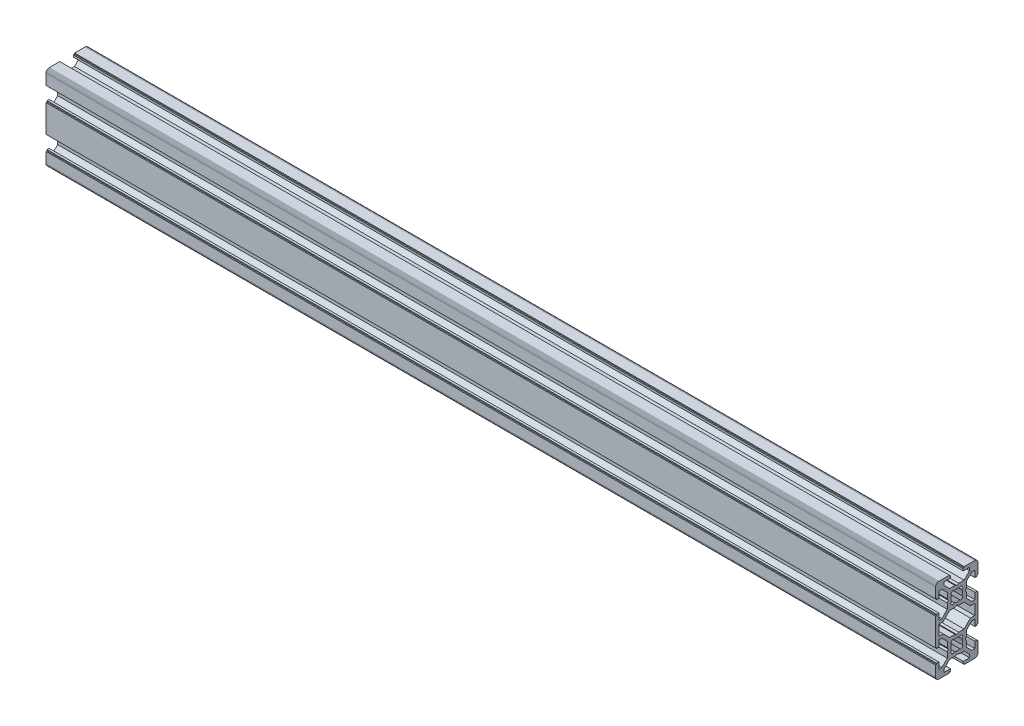
from build123d import *

# Parameters (mm, degrees)
F_20MM_20X40_1_DEPTH = 420


with BuildPart() as part:
    # Model1 → 20mm 20X40(1) (new body)
    with BuildSketch(Plane.YZ):
        Polygon((-19.998489, -8.567297), (-20, -8.5), (-20, -3.5), (-19.5, -3.5), (-19.5, -3), (-18.5, -3), (-18.5, -6), (-17.060659, -6), (-14.5, -3.43934), (-14.5, -0.866025), (-14, 0), (-14.5, 0.866025), (-14.5, 3.43934), (-17.060659, 6), (-18.5, 6), (-18.5, 3), (-19.5, 3), (-19.5, 3.5), (-20, 3.5), (-20, 8.5), (-19.998489, 8.567297), (-19.993961, 8.634459), (-19.986425, 8.70135), (-19.975895, 8.767836), (-19.962391, 8.833781), (-19.945944, 8.899055), (-19.926584, 8.963526), (-19.904352, 9.027062), (-19.879292, 9.089538), (-19.851454, 9.150826), (-19.820892, 9.210803), (-19.787674, 9.269349), (-19.75186, 9.326345), (-19.713526, 9.381678), (-19.672747, 9.435235), (-19.629606, 9.486908), (-19.584192, 9.536594), (-19.536594, 9.584192), (-19.486908, 9.629607), (-19.435234, 9.672748), (-19.381678, 9.713526), (-19.326345, 9.75186), (-19.269348, 9.787673), (-19.210802, 9.820893), (-19.150826, 9.851453), (-19.089537, 9.879292), (-19.027061, 9.904352), (-18.963526, 9.926585), (-18.899055, 9.945944), (-18.833782, 9.962392), (-18.767836, 9.975894), (-18.701349, 9.986424), (-18.634459, 9.993961), (-18.567297, 9.998489), (-18.5, 10), (-13.5, 10), (-13.5, 9.5), (-13, 9.5), (-13, 8.5), (-16, 8.5), (-16, 7.06066), (-13.43934, 4.5), (-10.866025, 4.5), (-10, 4), (-9.133975, 4.5), (-6.56066, 4.5), (-4, 7.06066), (-4, 8.5), (-7, 8.5), (-7, 9.5), (-6.5, 9.5), (-6.5, 10), (6.5, 10), (6.5, 9.5), (7, 9.5), (7, 8.5), (4, 8.5), (4, 7.06066), (6.56066, 4.5), (9.133975, 4.5), (10, 4), (10.866025, 4.5), (13.43934, 4.5), (16, 7.06066), (16, 8.5), (13, 8.5), (13, 9.5), (13.5, 9.5), (13.5, 10), (18.5, 10), (18.567297, 9.998489), (18.634459, 9.993961), (18.701349, 9.986424), (18.767836, 9.975894), (18.833782, 9.962392), (18.899055, 9.945944), (18.963526, 9.926585), (19.027061, 9.904352), (19.089537, 9.879292), (19.150826, 9.851453), (19.210802, 9.820893), (19.269348, 9.787673), (19.326345, 9.75186), (19.381678, 9.713526), (19.435234, 9.672748), (19.486908, 9.629607), (19.536594, 9.584192), (19.584192, 9.536594), (19.629606, 9.486908), (19.672747, 9.435235), (19.713526, 9.381678), (19.75186, 9.326345), (19.787674, 9.269349), (19.820892, 9.210803), (19.851454, 9.150826), (19.879292, 9.089538), (19.904352, 9.027062), (19.926584, 8.963526), (19.945944, 8.899055), (19.962391, 8.833781), (19.975895, 8.767836), (19.986425, 8.70135), (19.993961, 8.634459), (19.998489, 8.567297), (20, 8.5), (20, 3.5), (19.5, 3.5), (19.5, 3), (18.5, 3), (18.5, 6), (17.060659, 6), (14.5, 3.43934), (14.5, 0.866025), (14, 0), (14.5, -0.866025), (14.5, -3.43934), (17.060659, -6), (18.5, -6), (18.5, -3), (19.5, -3), (19.5, -3.5), (20, -3.5), (20, -8.5), (19.998489, -8.567297), (19.993961, -8.634459), (19.986425, -8.70135), (19.975895, -8.767836), (19.962391, -8.833781), (19.945944, -8.899055), (19.926584, -8.963526), (19.904352, -9.027062), (19.879292, -9.089538), (19.851454, -9.150826), (19.820892, -9.210803), (19.787674, -9.269349), (19.75186, -9.326345), (19.713526, -9.381678), (19.672747, -9.435235), (19.629606, -9.486908), (19.584192, -9.536594), (19.536594, -9.584192), (19.486908, -9.629607), (19.435234, -9.672748), (19.381678, -9.713526), (19.326345, -9.75186), (19.269348, -9.787673), (19.210802, -9.820893), (19.150826, -9.851453), (19.089537, -9.879292), (19.027061, -9.904352), (18.963526, -9.926585), (18.899055, -9.945944), (18.833782, -9.962392), (18.767836, -9.975894), (18.701349, -9.986424), (18.634459, -9.993961), (18.567297, -9.998489), (18.5, -10), (13.5, -10), (13.5, -9.5), (13, -9.5), (13, -8.5), (16, -8.5), (16, -7.06066), (13.43934, -4.5), (10.866025, -4.5), (10, -4), (9.133975, -4.5), (6.56066, -4.5), (4, -7.06066), (4, -8.5), (7, -8.5), (7, -9.5), (6.5, -9.5), (6.5, -10), (-6.5, -10), (-6.5, -9.5), (-7, -9.5), (-7, -8.5), (-4, -8.5), (-4, -7.06066), (-6.56066, -4.5), (-9.133975, -4.5), (-10, -4), (-10.866025, -4.5), (-13.43934, -4.5), (-16, -7.06066), (-16, -8.5), (-13, -8.5), (-13, -9.5), (-13.5, -9.5), (-13.5, -10), (-18.5, -10), (-18.567297, -9.998489), (-18.634459, -9.993961), (-18.701349, -9.986424), (-18.767836, -9.975894), (-18.833782, -9.962392), (-18.899055, -9.945944), (-18.963526, -9.926585), (-19.027061, -9.904352), (-19.089537, -9.879292), (-19.150826, -9.851453), (-19.210802, -9.820893), (-19.269348, -9.787673), (-19.326345, -9.75186), (-19.381678, -9.713526), (-19.435234, -9.672748), (-19.486908, -9.629607), (-19.536594, -9.584192), (-19.584192, -9.536594), (-19.629606, -9.486908), (-19.672747, -9.435235), (-19.713526, -9.381678), (-19.75186, -9.326345), (-19.787674, -9.269349), (-19.820892, -9.210803), (-19.851454, -9.150826), (-19.879292, -9.089538), (-19.904352, -9.027062), (-19.926584, -8.963526), (-19.945944, -8.899055), (-19.962391, -8.833781), (-19.975895, -8.767836), (-19.986425, -8.70135), (-19.993961, -8.634459), align=None)
        Polygon((-7.250888, 0.06988), (-7.257988, 0.209458), (-7.272171, 0.348496), (-7.293399, 0.486634), (-7.321618, 0.623514), (-7.356755, 0.758785), (-7.398718, 0.892095), (-7.447401, 1.023101), (-7.502676, 1.151465), (-7.564401, 1.276855), (-7.052327, 1.887121), (-7.128679, 2.001379), (-7.209457, 2.112551), (-7.294538, 2.220467), (-7.383788, 2.32496), (-7.477072, 2.425868), (-7.574245, 2.523037), (-7.675158, 2.616316), (-7.779655, 2.705562), (-7.887574, 2.790637), (-7.99875, 2.871411), (-8.113011, 2.947757), (-8.723289, 2.435674), (-8.848666, 2.497385), (-8.977017, 2.552647), (-9.10801, 2.601318), (-9.241305, 2.643271), (-9.37656, 2.678399), (-9.513425, 2.706611), (-9.651546, 2.727834), (-9.790567, 2.742013), (-9.930129, 2.749112), (-10.069871, 2.749112), (-10.209433, 2.742013), (-10.348454, 2.727834), (-10.486575, 2.706611), (-10.62344, 2.678399), (-10.758695, 2.643271), (-10.89199, 2.601318), (-11.022983, 2.552647), (-11.151334, 2.497385), (-11.276711, 2.435674), (-11.886989, 2.947757), (-12.001249, 2.871411), (-12.112426, 2.790637), (-12.220345, 2.705562), (-12.324841, 2.616316), (-12.425755, 2.523037), (-12.522927, 2.425868), (-12.616212, 2.32496), (-12.705462, 2.220467), (-12.790543, 2.112551), (-12.871321, 2.001379), (-12.947673, 1.887121), (-12.435598, 1.276855), (-12.497324, 1.151465), (-12.552599, 1.023101), (-12.601282, 0.892095), (-12.643246, 0.758785), (-12.678382, 0.623514), (-12.706601, 0.486634), (-12.727829, 0.348496), (-12.742011, 0.209458), (-12.749112, 0.06988), (-12.749112, -0.06988), (-12.742011, -0.209458), (-12.727829, -0.348496), (-12.706601, -0.486634), (-12.678382, -0.623514), (-12.643246, -0.758785), (-12.601282, -0.892095), (-12.552599, -1.023101), (-12.497324, -1.151465), (-12.435598, -1.276855), (-12.947673, -1.887121), (-12.871321, -2.001379), (-12.790543, -2.112551), (-12.705462, -2.220467), (-12.616212, -2.32496), (-12.522927, -2.425868), (-12.425755, -2.523037), (-12.324841, -2.616316), (-12.220345, -2.705562), (-12.112426, -2.790637), (-12.001249, -2.871411), (-11.886989, -2.947757), (-11.276711, -2.435674), (-11.151334, -2.497385), (-11.022983, -2.552647), (-10.89199, -2.601318), (-10.758695, -2.643271), (-10.62344, -2.678399), (-10.486575, -2.706611), (-10.348454, -2.727834), (-10.209433, -2.742013), (-10.069871, -2.749112), (-9.930129, -2.749112), (-9.790567, -2.742013), (-9.651546, -2.727834), (-9.513425, -2.706611), (-9.37656, -2.678399), (-9.241305, -2.643271), (-9.10801, -2.601318), (-8.977017, -2.552647), (-8.848666, -2.497385), (-8.723289, -2.435674), (-8.113011, -2.947757), (-7.99875, -2.871411), (-7.887574, -2.790637), (-7.779655, -2.705562), (-7.675158, -2.616316), (-7.574245, -2.523037), (-7.477072, -2.425868), (-7.383788, -2.32496), (-7.294538, -2.220467), (-7.209457, -2.112551), (-7.128679, -2.001379), (-7.052327, -1.887121), (-7.564401, -1.276855), (-7.502676, -1.151465), (-7.447401, -1.023101), (-7.398718, -0.892095), (-7.356755, -0.758785), (-7.321618, -0.623514), (-7.293399, -0.486634), (-7.272171, -0.348496), (-7.257988, -0.209458), (-7.250888, -0.06988), align=None, mode=Mode.SUBTRACT)
        Polygon((12.749112, 0.06988), (12.742011, 0.209458), (12.727829, 0.348496), (12.706601, 0.486634), (12.678382, 0.623514), (12.643246, 0.758785), (12.601282, 0.892095), (12.552599, 1.023101), (12.497324, 1.151465), (12.435598, 1.276855), (12.947673, 1.887121), (12.871321, 2.001379), (12.790543, 2.112551), (12.705462, 2.220467), (12.616212, 2.32496), (12.522927, 2.425868), (12.425755, 2.523037), (12.324841, 2.616316), (12.220345, 2.705562), (12.112426, 2.790637), (12.001249, 2.871411), (11.886989, 2.947757), (11.276711, 2.435674), (11.151334, 2.497385), (11.022983, 2.552647), (10.89199, 2.601318), (10.758695, 2.643271), (10.62344, 2.678399), (10.486575, 2.706611), (10.348454, 2.727834), (10.209433, 2.742013), (10.069871, 2.749112), (9.930129, 2.749112), (9.790567, 2.742013), (9.651546, 2.727834), (9.513425, 2.706611), (9.37656, 2.678399), (9.241305, 2.643271), (9.10801, 2.601318), (8.977017, 2.552647), (8.848666, 2.497385), (8.723289, 2.435674), (8.113011, 2.947757), (7.99875, 2.871411), (7.887574, 2.790637), (7.779655, 2.705562), (7.675158, 2.616316), (7.574245, 2.523037), (7.477072, 2.425868), (7.383788, 2.32496), (7.294538, 2.220467), (7.209457, 2.112551), (7.128679, 2.001379), (7.052327, 1.887121), (7.564401, 1.276855), (7.487299, 1.117512), (7.420608, 0.953539), (7.364604, 0.785615), (7.31952, 0.614435), (7.285543, 0.44071), (7.262813, 0.265158), (7.251425, 0.088508), (7.251425, -0.088508), (7.262813, -0.265158), (7.285543, -0.44071), (7.31952, -0.614435), (7.364604, -0.785615), (7.420608, -0.953539), (7.487299, -1.117512), (7.564401, -1.276855), (7.052327, -1.887121), (7.128679, -2.001379), (7.209457, -2.112551), (7.294538, -2.220467), (7.383788, -2.32496), (7.477072, -2.425868), (7.574245, -2.523037), (7.675158, -2.616316), (7.779655, -2.705562), (7.887574, -2.790637), (7.99875, -2.871411), (8.113011, -2.947757), (8.723289, -2.435674), (8.848666, -2.497385), (8.977017, -2.552647), (9.10801, -2.601318), (9.241305, -2.643271), (9.37656, -2.678399), (9.513425, -2.706611), (9.651546, -2.727834), (9.790567, -2.742013), (9.930129, -2.749112), (10.069871, -2.749112), (10.209433, -2.742013), (10.348454, -2.727834), (10.486575, -2.706611), (10.62344, -2.678399), (10.758695, -2.643271), (10.89199, -2.601318), (11.022983, -2.552647), (11.151334, -2.497385), (11.276711, -2.435674), (11.886989, -2.947757), (12.001249, -2.871411), (12.112426, -2.790637), (12.220345, -2.705562), (12.324841, -2.616316), (12.425755, -2.523037), (12.522927, -2.425868), (12.616212, -2.32496), (12.705462, -2.220467), (12.790543, -2.112551), (12.871321, -2.001379), (12.947673, -1.887121), (12.435598, -1.276855), (12.497324, -1.151465), (12.552599, -1.023101), (12.601282, -0.892095), (12.643246, -0.758785), (12.678382, -0.623514), (12.706601, -0.486634), (12.727829, -0.348496), (12.742011, -0.209458), (12.749112, -0.06988), align=None, mode=Mode.SUBTRACT)
        Polygon((-5.5, -0.866025), (-6, 0), (-5.5, 0.866025), (-5.5, 3.43934), (-2.5, 6.43934), (-2.5, 8.5), (2.5, 8.5), (2.5, 6.43934), (5.5, 3.43934), (5.5, 0.866025), (6, 0), (5.5, -0.866025), (5.5, -3.43934), (2.5, -6.43934), (2.5, -8.5), (-2.5, -8.5), (-2.5, -6.43934), (-5.5, -3.43934), align=None, mode=Mode.SUBTRACT)
    extrude(amount=F_20MM_20X40_1_DEPTH)


solid = part.part
